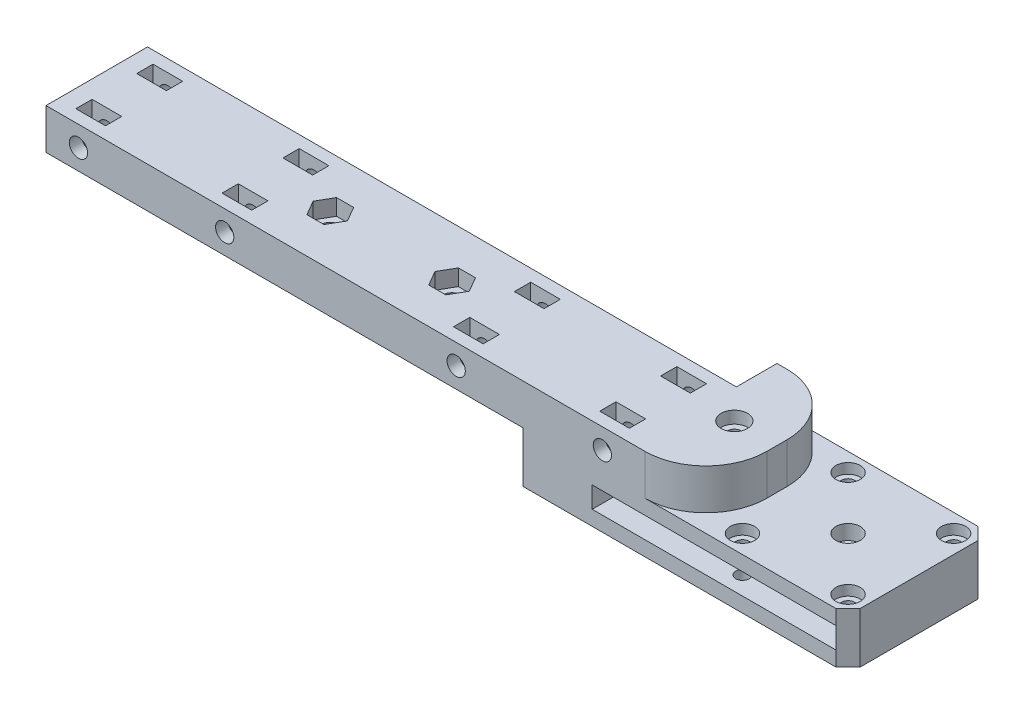
from build123d import *

# Parameters (mm, degrees)
SKETCH1_W           = 145
SKETCH1_H           = 25
BOSS_EXTRUDE1_DEPTH = 10
SKETCH2_W           = 17.5
SKETCH2_H           = 35
BOSS_EXTRUDE2_DEPTH = 10
SKETCH4_W           = 80
SKETCH4_H           = 35
BOSS_EXTRUDE3_DEPTH = 12.5
SKETCH8_R           = 2.25
CUT_EXTRUDE5_DEPTH  = 200.468042553
SKETCH9_W           = 7.3
SKETCH9_H           = 4
CUT_EXTRUDE6_DEPTH  = 10
CUT_EXTRUDE7_REACH  = 202.966
SKETCH10_R          = 3
SKETCH10_R_2        = 1.65
CHAMFER1_SIZE       = 3
FILLET1_R           = 15
SKETCH14_R          = 11.25
CUT_EXTRUDE11_DEPTH = 2.5
SKETCH15_R          = 3
CUT_EXTRUDE12_DEPTH = 2.5
CUT_EXTRUDE13_REACH = 203.835
SKETCH16_R          = 2.25
CUT_EXTRUDE15_DEPTH = 4
CUT_EXTRUDE16_REACH = 202.966
SKETCH19_W          = 60
SKETCH19_H          = 5.2
SKETCH20_R          = 1.75
CUT_EXTRUDE17_DEPTH = 202.835328919
SKETCH21_W          = 24
SKETCH21_H          = 24
CUT_EXTRUDE18_DEPTH = 2
CUT_EXTRUDE19_REACH = 203.622
SKETCH22_R          = 1.65
SKETCH22_W          = 16
SKETCH22_H          = 9
SKETCH23_R          = 3.25
CUT_EXTRUDE20_DEPTH = 3
CUT_EXTRUDE21_START = -3
SKETCH24_R          = 3.25
CUT_EXTRUDE21_DEPTH = 3


with BuildPart() as part:
    # Sketch1 → Boss-Extrude1 (new body)
    with BuildSketch(Plane(origin=(0, 0, 0), x_dir=(1, 0, 0), z_dir=(0, 1, 0))):
        with Locations((72.5, 12.5)):
            Rectangle(SKETCH1_W, SKETCH1_H)
    extrude(amount=BOSS_EXTRUDE1_DEPTH)

    # Sketch2 → Boss-Extrude2 (add)
    with BuildSketch(Plane(origin=(0, 10, 0), x_dir=(1, 0, 0), z_dir=(0, 1, 0))):
        with Locations((153.75, 17.5)):
            Rectangle(SKETCH2_W, SKETCH2_H)
    extrude(amount=-BOSS_EXTRUDE2_DEPTH)

    # Sketch4 → Boss-Extrude3 (add)
    with BuildSketch(Plane.XZ):
        with Locations((157.5, -17.5)):
            Rectangle(SKETCH4_W, SKETCH4_H)
    extrude(amount=BOSS_EXTRUDE3_DEPTH)

    # Sketch8 → Cut-Extrude5 (cut, through all)
    with BuildSketch(Plane(origin=(0, 0, -25), x_dir=(-1, 0, 0), z_dir=(0, 0, -1))):
        with Locations((-137, 5)):
            Circle(SKETCH8_R)
        with Locations((-101, 5)):
            Circle(SKETCH8_R)
        with Locations(Location((-44, 5, 0), (0, 0, 180))):
            Circle(SKETCH8_R)
        with Locations(Location((-8, 5, 0), (0, 0, 180))):
            Circle(SKETCH8_R)
    extrude(amount=-CUT_EXTRUDE5_DEPTH, mode=Mode.SUBTRACT)

    # Sketch9 → Cut-Extrude6 (cut)
    with BuildSketch(Plane(origin=(0, 10, 0), x_dir=(1, 0, 0), z_dir=(0, 1, 0))):
        with Locations((137, 20)):
            Rectangle(SKETCH9_W, SKETCH9_H)
        with Locations((137, 5)):
            Rectangle(SKETCH9_W, SKETCH9_H)
        with Locations((101, 5)):
            Rectangle(SKETCH9_W, SKETCH9_H)
        with Locations((101, 20)):
            Rectangle(SKETCH9_W, SKETCH9_H)
        with Locations((8, 20)):
            Rectangle(SKETCH9_W, SKETCH9_H)
        with Locations((44, 20)):
            Rectangle(SKETCH9_W, SKETCH9_H)
        with Locations((44, 5)):
            Rectangle(SKETCH9_W, SKETCH9_H)
        with Locations((8, 5)):
            Rectangle(SKETCH9_W, SKETCH9_H)
    extrude(amount=-CUT_EXTRUDE6_DEPTH, mode=Mode.SUBTRACT)

    # Sketch10 → Cut-Extrude7 (cut, up to next)
    with BuildSketch(Plane(origin=(0, 0, 0), x_dir=(1, 0, 0), z_dir=(0, 1, 0)), mode=Mode.PRIVATE) as cut_extrude7_sk1:
        with Locations(Location((180, 17.5, 0), (0, 0, 270))):
            Circle(SKETCH10_R)
    cut_extrude7_tool1 = extrude(cut_extrude7_sk1.sketch, amount=-CUT_EXTRUDE7_REACH, mode=Mode.PRIVATE) & part.part
    # Sketch10 → Cut-Extrude7 (cut, up to next)
    with BuildSketch(Plane(origin=(0, 0, 0), x_dir=(1, 0, 0), z_dir=(0, 1, 0)), mode=Mode.PRIVATE) as cut_extrude7_sk2:
        with Locations(Location((193, 4.5, 0), (0, 0, 270))):
            Circle(SKETCH10_R_2)
    cut_extrude7_tool2 = extrude(cut_extrude7_sk2.sketch, amount=-CUT_EXTRUDE7_REACH, mode=Mode.PRIVATE) & part.part
    # Sketch10 → Cut-Extrude7 (cut, up to next)
    with BuildSketch(Plane(origin=(0, 0, 0), x_dir=(1, 0, 0), z_dir=(0, 1, 0)), mode=Mode.PRIVATE) as cut_extrude7_sk3:
        with Locations(Location((167, 4.5, 0), (0, 0, 90))):
            Circle(SKETCH10_R_2)
    cut_extrude7_tool3 = extrude(cut_extrude7_sk3.sketch, amount=-CUT_EXTRUDE7_REACH, mode=Mode.PRIVATE) & part.part
    # Sketch10 → Cut-Extrude7 (cut, up to next)
    with BuildSketch(Plane(origin=(0, 0, 0), x_dir=(1, 0, 0), z_dir=(0, 1, 0)), mode=Mode.PRIVATE) as cut_extrude7_sk4:
        with Locations(Location((167, 30.5, 0), (0, 0, 270))):
            Circle(SKETCH10_R_2)
    cut_extrude7_tool4 = extrude(cut_extrude7_sk4.sketch, amount=-CUT_EXTRUDE7_REACH, mode=Mode.PRIVATE) & part.part
    # Sketch10 → Cut-Extrude7 (cut, up to next)
    with BuildSketch(Plane(origin=(0, 0, 0), x_dir=(1, 0, 0), z_dir=(0, 1, 0)), mode=Mode.PRIVATE) as cut_extrude7_sk5:
        with Locations(Location((193, 30.5, 0), (0, 0, 90))):
            Circle(SKETCH10_R_2)
    cut_extrude7_tool5 = extrude(cut_extrude7_sk5.sketch, amount=-CUT_EXTRUDE7_REACH, mode=Mode.PRIVATE) & part.part
    add(cut_extrude7_tool1.solids().sort_by_distance((180, 0, -17.5))[0], mode=Mode.SUBTRACT)
    add(cut_extrude7_tool2.solids().sort_by_distance((193, 0, -4.5))[0], mode=Mode.SUBTRACT)
    add(cut_extrude7_tool3.solids().sort_by_distance((167, 0, -4.5))[0], mode=Mode.SUBTRACT)
    add(cut_extrude7_tool4.solids().sort_by_distance((167, 0, -30.5))[0], mode=Mode.SUBTRACT)
    add(cut_extrude7_tool5.solids().sort_by_distance((193, 0, -30.5))[0], mode=Mode.SUBTRACT)

    # Chamfer1
    chamfer1_edges = [part.edges().sort_by_distance(p)[0] for p in [
        (197.5, -6.25, -35),
        (197.5, -6.25, 0),
    ]]
    chamfer(chamfer1_edges, length=CHAMFER1_SIZE)

    # Fillet1
    fillet1_edges = [part.edges().sort_by_distance(p)[0] for p in [
        (162.5, 5, -35),
        (162.5, 5, 0),
    ]]
    fillet(fillet1_edges, radius=FILLET1_R)

    # Sketch14 → Cut-Extrude11 (cut)
    with BuildSketch(Plane.XZ.offset(12.5)):
        with Locations(Location((180, -17.5, 0), (0, 0, 270))):
            Circle(SKETCH14_R)
    extrude(amount=-CUT_EXTRUDE11_DEPTH, mode=Mode.SUBTRACT)

    # Sketch15 → Cut-Extrude12 (cut)
    with BuildSketch(Plane(origin=(0, 0, 0), x_dir=(1, 0, 0), z_dir=(0, 1, 0))):
        with Locations(Location((167, 30.5, 0), (0, 0, 270))):
            Circle(SKETCH15_R)
        with Locations(Location((193, 30.5, 0), (0, 0, 90))):
            Circle(SKETCH15_R)
        with Locations(Location((193, 4.5, 0), (0, 0, 270))):
            Circle(SKETCH15_R)
        with Locations(Location((167, 4.5, 0), (0, 0, 90))):
            Circle(SKETCH15_R)
    extrude(amount=-CUT_EXTRUDE12_DEPTH, mode=Mode.SUBTRACT)

    # Sketch16 → Cut-Extrude13 (cut, up to next)
    with BuildSketch(Plane(origin=(0, 10, 0), x_dir=(1, 0, 0), z_dir=(0, 1, 0)), mode=Mode.PRIVATE) as cut_extrude13_sk1:
        with Locations(Location((57.5, 12.5, 0), (0, 0, 270))):
            Circle(SKETCH16_R)
    cut_extrude13_tool1 = extrude(cut_extrude13_sk1.sketch, amount=-CUT_EXTRUDE13_REACH, mode=Mode.PRIVATE) & part.part
    # Sketch16 → Cut-Extrude13 (cut, up to next)
    with BuildSketch(Plane(origin=(0, 10, 0), x_dir=(1, 0, 0), z_dir=(0, 1, 0)), mode=Mode.PRIVATE) as cut_extrude13_sk2:
        with Locations(Location((87.5, 12.5, 0), (0, 0, 270))):
            Circle(SKETCH16_R)
    cut_extrude13_tool2 = extrude(cut_extrude13_sk2.sketch, amount=-CUT_EXTRUDE13_REACH, mode=Mode.PRIVATE) & part.part
    add(cut_extrude13_tool1.solids().sort_by_distance((57.5, 10, -12.5))[0], mode=Mode.SUBTRACT)
    add(cut_extrude13_tool2.solids().sort_by_distance((87.5, 10, -12.5))[0], mode=Mode.SUBTRACT)

    # Sketch18 → Cut-Extrude15 (cut)
    with BuildSketch(Plane(origin=(0, 10, 0), x_dir=(1, 0, 0), z_dir=(0, 1, 0))):
        Polygon((83.285343035, 12.5), (85.392671517, 8.85), (89.607328483, 8.85), (91.714656965, 12.5), (89.607328483, 16.15), (85.392671517, 16.15), align=None)
        Polygon((59.607328483, 16.15), (61.714656965, 12.5), (59.607328483, 8.85), (55.392671517, 8.85), (53.285343035, 12.5), (55.392671517, 16.15), align=None)
    extrude(amount=-CUT_EXTRUDE15_DEPTH, mode=Mode.SUBTRACT)

    # Sketch19 → Cut-Extrude16 (cut, up to next)
    with BuildSketch(Plane.XY, mode=Mode.PRIVATE) as cut_extrude16_sk1:
        with Locations((164.5, -6.25)):
            Rectangle(SKETCH19_W, SKETCH19_H)
    cut_extrude16_tool1 = extrude(cut_extrude16_sk1.sketch, amount=-CUT_EXTRUDE16_REACH, mode=Mode.PRIVATE) & part.part
    add(cut_extrude16_tool1.solids().sort_by_distance((164.5, -6.25, 0))[0], mode=Mode.SUBTRACT)

    # Sketch20 → Cut-Extrude17 (cut, through all)
    with BuildSketch(Plane(origin=(0, 10, 0), x_dir=(1, 0, 0), z_dir=(0, 1, 0))):
        with Locations(Location((152, 17.5, 0), (0, 0, 270))):
            Circle(SKETCH20_R)
    extrude(amount=-CUT_EXTRUDE17_DEPTH, mode=Mode.SUBTRACT)

    # Sketch21 → Cut-Extrude18 (cut)
    with BuildSketch(Plane.XZ.offset(12.5)):
        with Locations((152, -17.5)):
            Rectangle(SKETCH21_W, SKETCH21_H)
    extrude(amount=-CUT_EXTRUDE18_DEPTH, mode=Mode.SUBTRACT)

    # Sketch22 → Cut-Extrude19 (cut, up to next)
    with BuildSketch(Plane.XZ.offset(10.5), mode=Mode.PRIVATE) as cut_extrude19_sk1:
        with Locations(Location((144, -9.5, 0), (0, 0, 270))):
            Circle(SKETCH22_R)
    cut_extrude19_tool1 = extrude(cut_extrude19_sk1.sketch, amount=-CUT_EXTRUDE19_REACH, mode=Mode.PRIVATE) & part.part
    # Sketch22 → Cut-Extrude19 (cut, up to next)
    with BuildSketch(Plane.XZ.offset(10.5), mode=Mode.PRIVATE) as cut_extrude19_sk2:
        with Locations(Location((160, -9.5, 0), (0, 0, 270))):
            Circle(SKETCH22_R)
    cut_extrude19_tool2 = extrude(cut_extrude19_sk2.sketch, amount=-CUT_EXTRUDE19_REACH, mode=Mode.PRIVATE) & part.part
    # Sketch22 → Cut-Extrude19 (cut, up to next)
    with BuildSketch(Plane.XZ.offset(10.5), mode=Mode.PRIVATE) as cut_extrude19_sk3:
        with Locations(Location((160, -25.5, 0), (0, 0, 270))):
            Circle(SKETCH22_R)
    cut_extrude19_tool3 = extrude(cut_extrude19_sk3.sketch, amount=-CUT_EXTRUDE19_REACH, mode=Mode.PRIVATE) & part.part
    # Sketch22 → Cut-Extrude19 (cut, up to next)
    with BuildSketch(Plane.XZ.offset(10.5), mode=Mode.PRIVATE) as cut_extrude19_sk4:
        with Locations(Location((144, -25.5, 0), (0, 0, 270))):
            Circle(SKETCH22_R)
    cut_extrude19_tool4 = extrude(cut_extrude19_sk4.sketch, amount=-CUT_EXTRUDE19_REACH, mode=Mode.PRIVATE) & part.part
    # Sketch22 → Cut-Extrude19 (cut, up to next)
    with BuildSketch(Plane.XZ.offset(10.5), mode=Mode.PRIVATE) as cut_extrude19_sk5:
        with Locations((152, -17.5)):
            Rectangle(SKETCH22_W, SKETCH22_H)
    cut_extrude19_tool5 = extrude(cut_extrude19_sk5.sketch, amount=-CUT_EXTRUDE19_REACH, mode=Mode.PRIVATE) & part.part
    add(cut_extrude19_tool1.solids().sort_by_distance((144, -10.5, -9.5))[0], mode=Mode.SUBTRACT)
    add(cut_extrude19_tool2.solids().sort_by_distance((160, -10.5, -9.5))[0], mode=Mode.SUBTRACT)
    add(cut_extrude19_tool3.solids().sort_by_distance((160, -10.5, -25.5))[0], mode=Mode.SUBTRACT)
    add(cut_extrude19_tool4.solids().sort_by_distance((144, -10.5, -25.5))[0], mode=Mode.SUBTRACT)
    add(cut_extrude19_tool5.solids().sort_by_distance((152, -10.5, -17.5))[0], mode=Mode.SUBTRACT)

    # Sketch23 → Cut-Extrude20 (cut)
    with BuildSketch(Plane(origin=(0, 10, 0), x_dir=(1, 0, 0), z_dir=(0, 1, 0))):
        with Locations(Location((152, 17.5, 0), (0, 0, 270))):
            Circle(SKETCH23_R)
    extrude(amount=-CUT_EXTRUDE20_DEPTH, mode=Mode.SUBTRACT)

    # Sketch24 → Cut-Extrude21 (cut)
    with BuildSketch(Plane.XZ.offset(3.65).offset(CUT_EXTRUDE21_START)):
        with Locations(Location((152, -17.5, 0), (0, 0, 90))):
            Circle(SKETCH24_R)
    extrude(amount=CUT_EXTRUDE21_DEPTH, mode=Mode.SUBTRACT)


solid = part.part
